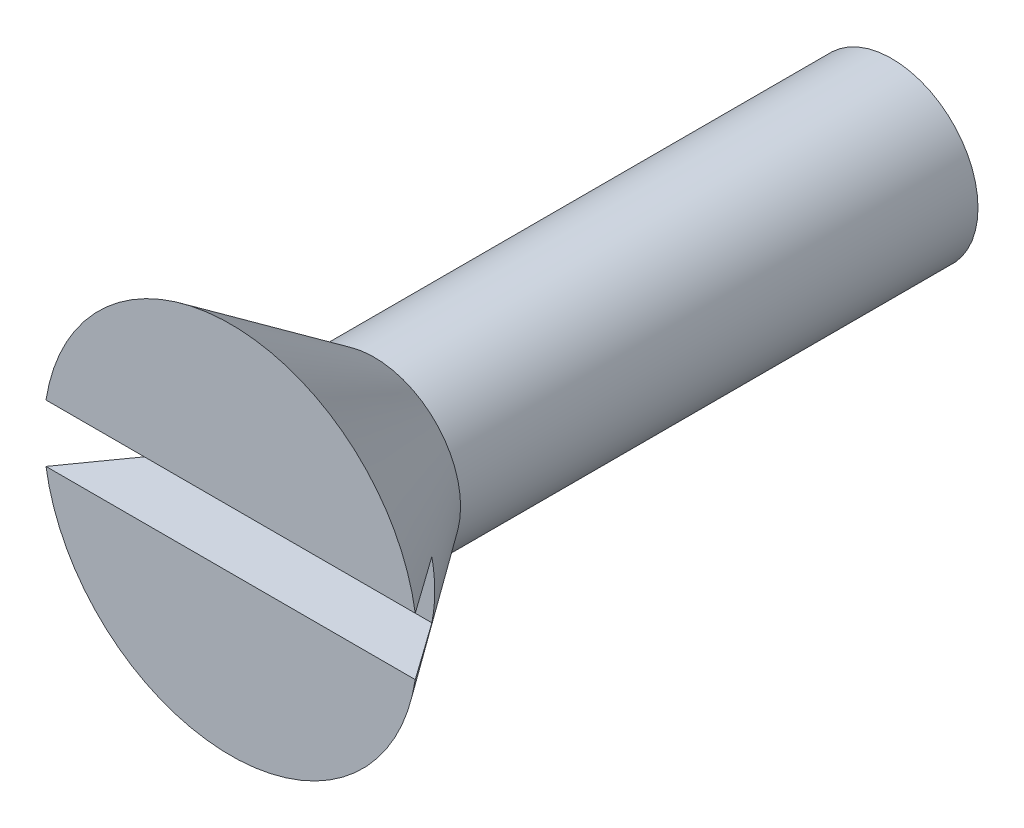
from build123d import *

# Parameters (mm, degrees)
CUT_EXTRUDE1_DEPTH      = 17.873425219
CUT_EXTRUDE1_DEPTH_BACK = 17.873425219
SKETCH3_W               = 4
SKETCH3_H               = 2


with BuildPart() as part:
    # Sketch1 → Revolve1 (revolve)
    with BuildSketch(Plane(origin=(0, 0, 0), x_dir=(0, 0, -1), z_dir=(1, 0, 0)), mode=Mode.PRIVATE) as revolve1_sk:
        Polygon((10.582404924, 0), (8.850354117, 3), (-9.149645883, 3), (-14.149645883, 6.5), (-14.149645883, 0), align=None)
    revolve(revolve1_sk.sketch.rotate(Axis((0, 0, 20.182835821), (0, 0, -1)), 90), axis=Axis((0, 0, 20.182835821), (0, 0, -1)))

    # Sketch3 → Cut-Extrude1 (cut, two sides: drawn at the far end of the back side and taken through both)
    with BuildSketch(Plane(origin=(0, 0, 0), x_dir=(0, 0, -1), z_dir=(1, 0, 0)).offset(-CUT_EXTRUDE1_DEPTH_BACK)):
        with Locations((-14.149645883, 0)):
            Rectangle(SKETCH3_W, SKETCH3_H)
    extrude(amount=CUT_EXTRUDE1_DEPTH + CUT_EXTRUDE1_DEPTH_BACK, mode=Mode.SUBTRACT)


solid = part.part
